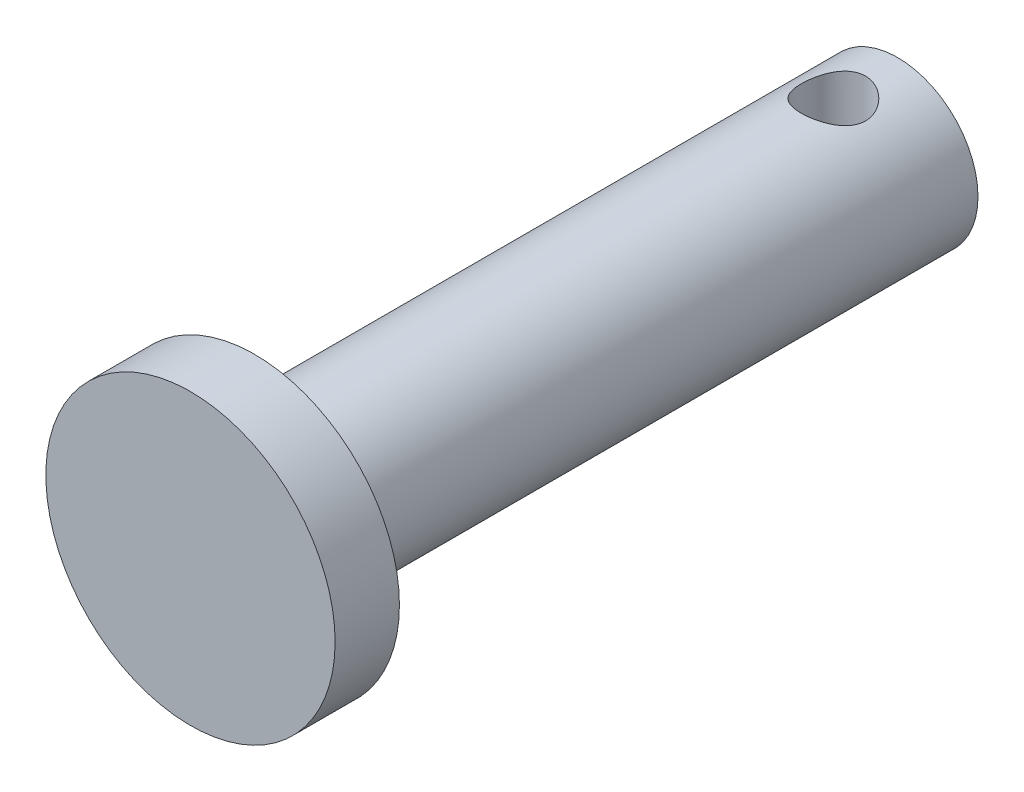
from build123d import *

# Parameters (mm, degrees)
SKETCH1_R               = 2.5
BOSS_EXTRUDE1_DEPTH     = 20
SKETCH2_R               = 4.5
BOSS_EXTRUDE2_DEPTH     = 2
CUT_EXTRUDE1_DEPTH      = 23.901964981
CUT_EXTRUDE1_DEPTH_BACK = 23.901964981
SKETCH3_R               = 1


with BuildPart() as part:
    # Sketch1 → Boss-Extrude1 (new body)
    with BuildSketch(Plane.XY):
        Circle(SKETCH1_R)
    extrude(amount=BOSS_EXTRUDE1_DEPTH)

    # Sketch2 → Boss-Extrude2 (add)
    with BuildSketch(Plane.XY.offset(20)):
        Circle(SKETCH2_R)
    extrude(amount=BOSS_EXTRUDE2_DEPTH)

    # Sketch3 → Cut-Extrude1 (cut, two sides: drawn at the far end of the back side and taken through both)
    with BuildSketch(Plane(origin=(0, 0, 0), x_dir=(1, 0, 0), z_dir=(0, 1, 0)).offset(-CUT_EXTRUDE1_DEPTH_BACK)):
        with Locations(Location((0, -2, 0), (0, 0, 270))):
            Circle(SKETCH3_R)
    extrude(amount=CUT_EXTRUDE1_DEPTH + CUT_EXTRUDE1_DEPTH_BACK, mode=Mode.SUBTRACT)


solid = part.part
